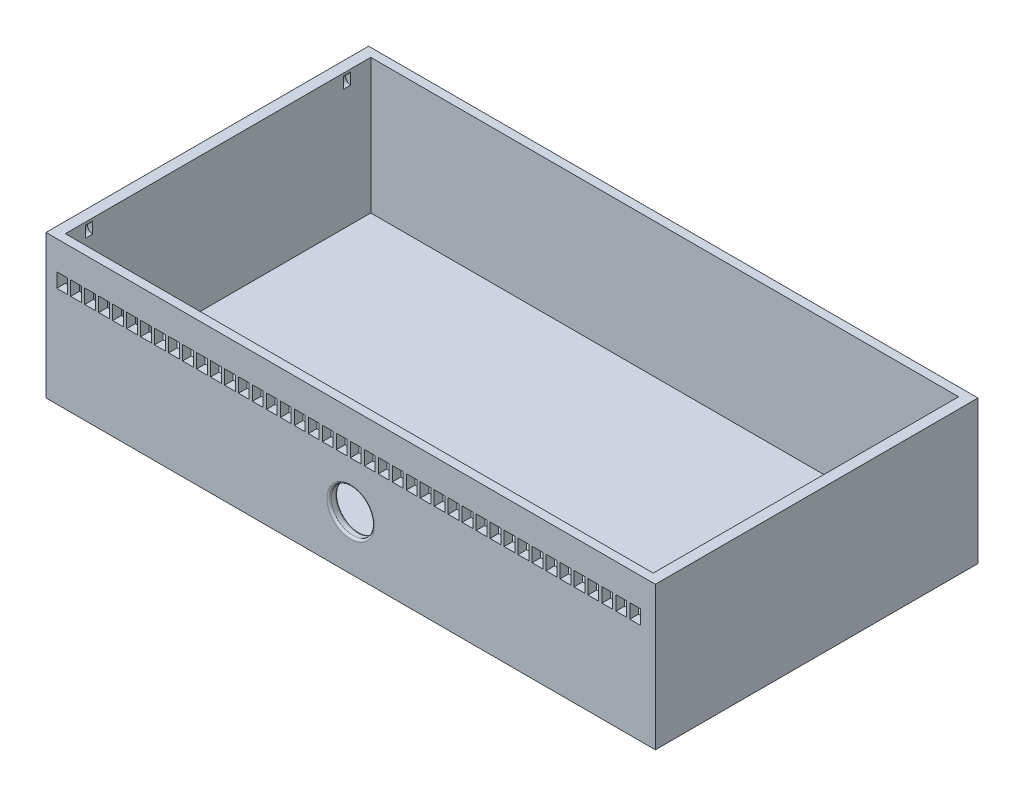
from build123d import *

# Parameters (mm, degrees)
SKETCH1_W               = 215.9
SKETCH1_H               = 114.3
BOSS_EXTRUDE1_DEPTH     = 50.8
SKETCH2_W               = 208.28
SKETCH2_H               = 108.204
CUT_EXTRUDE1_DEPTH      = 47.752
SKETCH3_W               = 3.81
SKETCH3_H               = 5.08
CUT_EXTRUDE2_DEPTH      = 7.62
LPATTERN1_COUNT         = 42
LPATTERN1_PITCH         = 4.953
SKETCH4_R               = 7.62
CUT_EXTRUDE3_DEPTH      = 7.62
SKETCH6_R               = 10.668
CUT_EXTRUDE5_DEPTH      = 7.62
SKETCH12_R              = 1.778
CUT_EXTRUDE7_DEPTH      = 2.54
MIRROR2_COPY_1_SKETCH_R = 1.778
MIRROR2_COPY_1_DEPTH    = 2.54
FILLET1_R               = 0.762
FILLET3_R               = 0.762


with BuildPart() as part:
    # Sketch1 → Boss-Extrude1 (new body)
    with BuildSketch(Plane(origin=(0, 0, 0), x_dir=(1, 0, 0), z_dir=(0, 1, 0))):
        Rectangle(SKETCH1_W, SKETCH1_H)
    extrude(amount=BOSS_EXTRUDE1_DEPTH)

    # Sketch2 → Cut-Extrude1 (cut)
    with BuildSketch(Plane(origin=(0, 50.8, 0), x_dir=(1, 0, 0), z_dir=(0, 1, 0))):
        Rectangle(SKETCH2_W, SKETCH2_H)
    extrude(amount=-CUT_EXTRUDE1_DEPTH, mode=Mode.SUBTRACT)

    # Sketch3 → Cut-Extrude2 (cut)
    with BuildSketch(Plane.XY.offset(57.15)):
        with Locations((-102.235, 38.1)):
            Rectangle(SKETCH3_W, SKETCH3_H)
    cut_extrude2 = extrude(amount=-CUT_EXTRUDE2_DEPTH, mode=Mode.SUBTRACT)

    # LPattern1: Cut-Extrude2 ×42
    with Locations(*[(i * LPATTERN1_PITCH, 0, 0) for i in range(1, LPATTERN1_COUNT)]):
        add(cut_extrude2, mode=Mode.SUBTRACT)

    # Sketch4 → Cut-Extrude3 (cut)
    with BuildSketch(Plane.XY.offset(57.15)):
        with Locations((0, 19.05)):
            Circle(SKETCH4_R)
    extrude(amount=-CUT_EXTRUDE3_DEPTH, mode=Mode.SUBTRACT)

    # Sketch6 → Cut-Extrude5 (cut)
    with BuildSketch(Plane(origin=(0, 0, -57.15), x_dir=(-1, 0, 0), z_dir=(0, 0, -1))):
        with Locations((-91.44, 15.24)):
            Circle(SKETCH6_R)
    extrude(amount=-CUT_EXTRUDE5_DEPTH, mode=Mode.SUBTRACT)

    # Sketch12 → Cut-Extrude7 (cut)
    with BuildSketch(Plane(origin=(0, 0, 44.45), x_dir=(-1, 0, 0), z_dir=(0, 0, -1))):
        with Locations((104.14, 47.625)):
            Circle(SKETCH12_R)
    cut_extrude7 = extrude(amount=-CUT_EXTRUDE7_DEPTH, mode=Mode.SUBTRACT)

    # Mirror1: Cut-Extrude7 across plane
    add(cut_extrude7.mirror(Plane(origin=(0, 0, 0), x_dir=(0, 0, 1), z_dir=(1, 0, 0))), mode=Mode.SUBTRACT)

    # Mirror2: Cut-Extrude7 across plane
    add(cut_extrude7.mirror(Plane.XY), mode=Mode.SUBTRACT)

    # Mirror2 copy 1 sketch → Mirror2 copy 1 (cut)
    with BuildSketch(Plane.XY.offset(-44.45)):
        with Locations((104.14, 47.625)):
            Circle(MIRROR2_COPY_1_SKETCH_R)
    extrude(amount=-MIRROR2_COPY_1_DEPTH, mode=Mode.SUBTRACT)

    # Fillet1
    fillet1_edges = [part.edges().sort_by_distance(p)[0] for p in [
        (-7.62, 19.05, 54.102),
        (-7.62, 19.05, 57.15),
        (102.108, 15.24, -54.102),
        (102.108, 15.24, -57.15),
    ]]
    fillet(fillet1_edges, radius=FILLET1_R)

    # Fillet3
    fillet3_edges = [part.edges().sort_by_distance(p)[0] for p in [
        (-104.14, 49.403, 45.72),
        (104.14, 49.403, 45.72),
        (104.14, 49.403, -45.72),
        (-104.14, 49.403, -45.72),
    ]]
    fillet(fillet3_edges, radius=FILLET3_R)


solid = part.part
